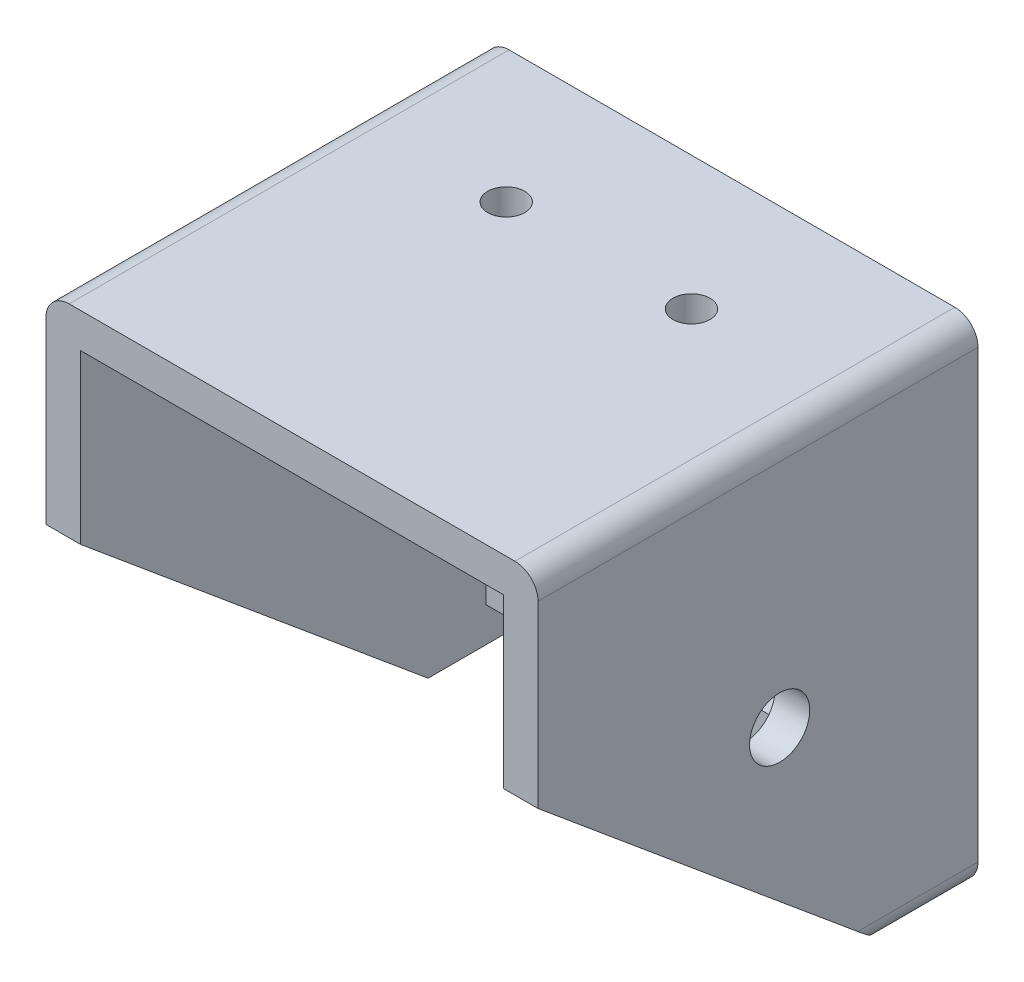
from build123d import *

# Parameters (mm, degrees)
SKETCH_1_W          = 26.5
SKETCH_1_H          = 14.5
EXTRUDE_1_DEPTH     = 3
SKETCH_4_R          = 6
CUT_EXTRUDE_1_DEPTH = 20
SKETCH_5_W          = 36.5
SKETCH_5_H          = 36.5
EXTRUDE_3_DEPTH     = 35
CUT_EXTRUDE_3_DEPTH = 45
SKETCH_9_R          = 2.6
CUT_EXTRUDE_4_DEPTH = 26
FILLET_1_R          = 2
SKETCH_10_R         = 1.6
CUT_EXTRUDE_5_DEPTH = 9
CUT_EXTRUDE_6_DEPTH = 36.5


with BuildPart() as part:
    # 草图1 → 凸台-拉伸1 (new body)
    with BuildSketch(Plane.XY):
        Polygon((29.5, -7), (34.5, -7), (34.5, 35.5), (29.5, 35.5), (-3, 35.5), (-8, 35.5), (-8, -7), (-3, -7), align=None)
        with Locations((13.25, 7.25)):
            Rectangle(SKETCH_1_W, SKETCH_1_H, mode=Mode.SUBTRACT)
    extrude(amount=EXTRUDE_1_DEPTH)

    # 草图4 → 切除-拉伸1 (cut)
    with BuildSketch(Plane.XY.offset(3)):
        with Locations((3.25, 25.5)):
            Circle(SKETCH_4_R)
        with Locations((23.25, 25.5)):
            Circle(SKETCH_4_R)
    extrude(amount=-CUT_EXTRUDE_1_DEPTH, mode=Mode.SUBTRACT)

    # 草图5 → 凸台-拉伸3 (add)
    with BuildSketch(Plane.XY.offset(3)):
        Polygon((-8, 35.5), (-8, 32.5), (-8, -7), (34.5, -7), (34.5, 35.5), align=None)
        with Locations((13.25, 14.25)):
            Rectangle(SKETCH_5_W, SKETCH_5_H, mode=Mode.SUBTRACT)
    extrude(amount=EXTRUDE_3_DEPTH)

    # 草图8 → 切除-拉伸3 (cut)
    with BuildSketch(Plane.ZY.offset(8)):
        Polygon((38, -7), (38, 8), (38, 18), (8, -7), align=None)
    extrude(amount=-CUT_EXTRUDE_3_DEPTH, mode=Mode.SUBTRACT)

    # 草图9 → 切除-拉伸4 (cut)
    with BuildSketch(Plane(origin=(34.5, 0, 0), x_dir=(0, 0, -1), z_dir=(1, 0, 0))):
        with Locations((-17.132149333, 13.627207238)):
            Circle(SKETCH_9_R)
    extrude(amount=-CUT_EXTRUDE_4_DEPTH, mode=Mode.SUBTRACT)

    # 圆角1
    fillet_1_edges = [part.edges().sort_by_distance(p)[0] for p in [
        (-8, 35.5, 19),
        (34.5, 35.5, 19),
        (34.5, -7, 4),
        (-8, -7, 4),
    ]]
    fillet(fillet_1_edges, radius=FILLET_1_R)

    # 草图10 → 切除-拉伸5 (cut)
    with BuildSketch(Plane(origin=(0, 35.5, 0), x_dir=(1, 0, 0), z_dir=(0, 1, 0))):
        with Locations(Location((21.25, -11.5, 0), (0, 0, 270))):
            Circle(SKETCH_10_R)
        with Locations(Location((5.25, -11.5, 0), (0, 0, 270))):
            Circle(SKETCH_10_R)
    extrude(amount=-CUT_EXTRUDE_5_DEPTH, mode=Mode.SUBTRACT)

    # 草图11 → 切除-拉伸6 (cut)
    with BuildSketch(Plane(origin=(-5, 0, 0), x_dir=(0, 0, -1), z_dir=(1, 0, 0))):
        Polygon((-3, -7), (0, -7), (-3, -4), (-14.237966717, -4), (-14.237966717, -7), align=None)
    extrude(amount=CUT_EXTRUDE_6_DEPTH, mode=Mode.SUBTRACT)


solid = part.part
